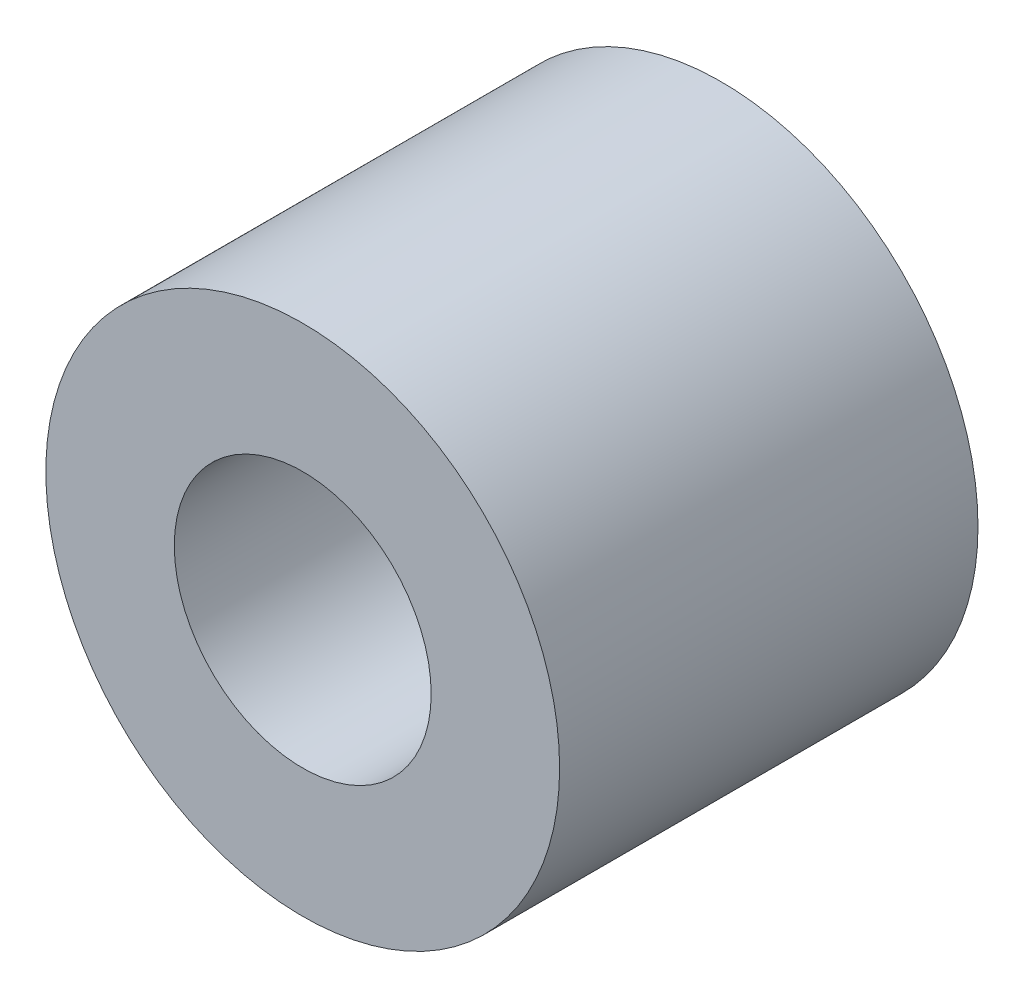
from build123d import *

# Parameters (mm, degrees)
ESBO_O1_R                = 3.5
ESBO_O1_R_2              = 1.75
RESSALTO_EXTRUS_O1_DEPTH = 5.7


with BuildPart() as part:
    # Esboço1 → Ressalto-extrusão1 (new body)
    with BuildSketch(Plane.XY):
        Circle(ESBO_O1_R)
        Circle(ESBO_O1_R_2, mode=Mode.SUBTRACT)
    extrude(amount=RESSALTO_EXTRUS_O1_DEPTH)


solid = part.part
